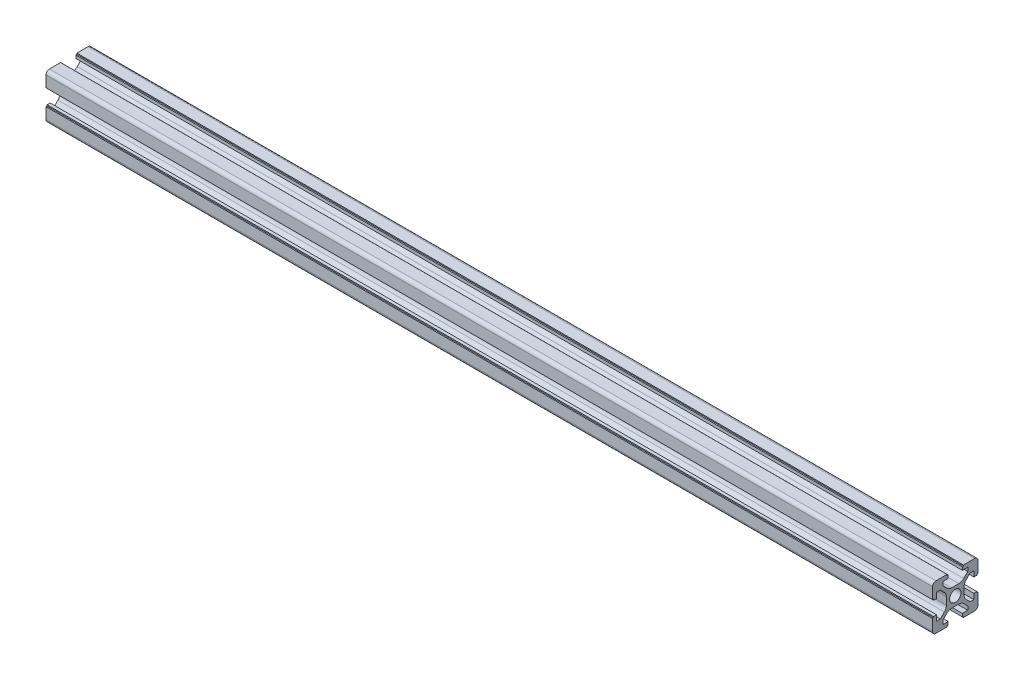
from build123d import *

# Parameters (mm, degrees)
EXTRUDE_1_DEPTH = 390
FILLET_1_R      = 1.5
FILLET_2_R      = 3


with BuildPart() as part:
    # 草图1 → 凸台-拉伸1 (new body)
    with BuildSketch(Plane(origin=(0, 0, 0), x_dir=(0, 0, -1), z_dir=(1, 0, 0))):
        Polygon((-10, 10), (-10, 3.6), (-9.530955747, 3.6), (-9.530955747, 3.1), (-8.2, 3.1), (-8.2, 5.5), (-6.560660172, 5.5), (-3.9, 2.839339828), (-3.9, 0), (-3.9, -2.839339828), (-6.560660172, -5.5), (-8.2, -5.5), (-8.2, -3.1), (-9.530955747, -3.1), (-9.530955747, -3.6), (-10, -3.6), (-10, -10), (-3.6, -10), (-3.6, -9.530955747), (-3.1, -9.530955747), (-3.1, -8.2), (-5.5, -8.2), (-5.5, -6.560660172), (-2.839339828, -3.9), (0, -3.9), (2.839339828, -3.9), (5.5, -6.560660172), (5.5, -8.2), (3.1, -8.2), (3.1, -9.530955747), (3.6, -9.530955747), (3.6, -10), (10, -10), (10, -3.6), (9.530955747, -3.6), (9.530955747, -3.1), (8.2, -3.1), (8.2, -5.5), (6.560660172, -5.5), (3.9, -2.839339828), (3.9, 0), (3.9, 2.839339828), (6.560660172, 5.5), (8.2, 5.5), (8.2, 3.1), (9.530955747, 3.1), (9.530955747, 3.6), (10, 3.6), (10, 10), (3.6, 10), (3.6, 9.530955747), (3.1, 9.530955747), (3.1, 8.2), (5.5, 8.2), (5.5, 6.560660172), (2.839339828, 3.9), (0, 3.9), (-2.839339828, 3.9), (-5.5, 6.560660172), (-5.5, 8.2), (-3.1, 8.2), (-3.1, 9.530955747), (-3.6, 9.530955747), (-3.6, 10), align=None)
        with BuildLine():
            ThreePointArc((0, 2.5), (-1.767766953, 1.767766953), (-2.5, 0))
            ThreePointArc((-2.5, 0), (-1.767766953, -1.767766953), (0, -2.5))
            ThreePointArc((0, -2.5), (1.767766953, -1.767766953), (2.5, 0))
            ThreePointArc((2.5, 0), (1.767766953, 1.767766953), (0, 2.5))
        make_face(mode=Mode.SUBTRACT)
    extrude(amount=EXTRUDE_1_DEPTH)

    # 圆角1
    fillet_1_edges = [part.edges().sort_by_distance(p)[0] for p in [
        (195, -10, -10),
        (195, -10, 10),
        (195, 10, 10),
        (195, 10, -10),
    ]]
    fillet(fillet_1_edges, radius=FILLET_1_R)

    # 圆角2
    fillet_2_edges = [part.edges().sort_by_distance(p)[0] for p in [
        (195, -3.9, -2.839339828),
        (195, -3.9, 2.839339828),
        (195, -2.839339828, 3.9),
        (195, 2.839339828, 3.9),
        (195, 3.9, 2.839339828),
        (195, 3.9, -2.839339828),
        (195, 2.839339828, -3.9),
        (195, -2.839339828, -3.9),
    ]]
    fillet(fillet_2_edges, radius=FILLET_2_R)


solid = part.part
